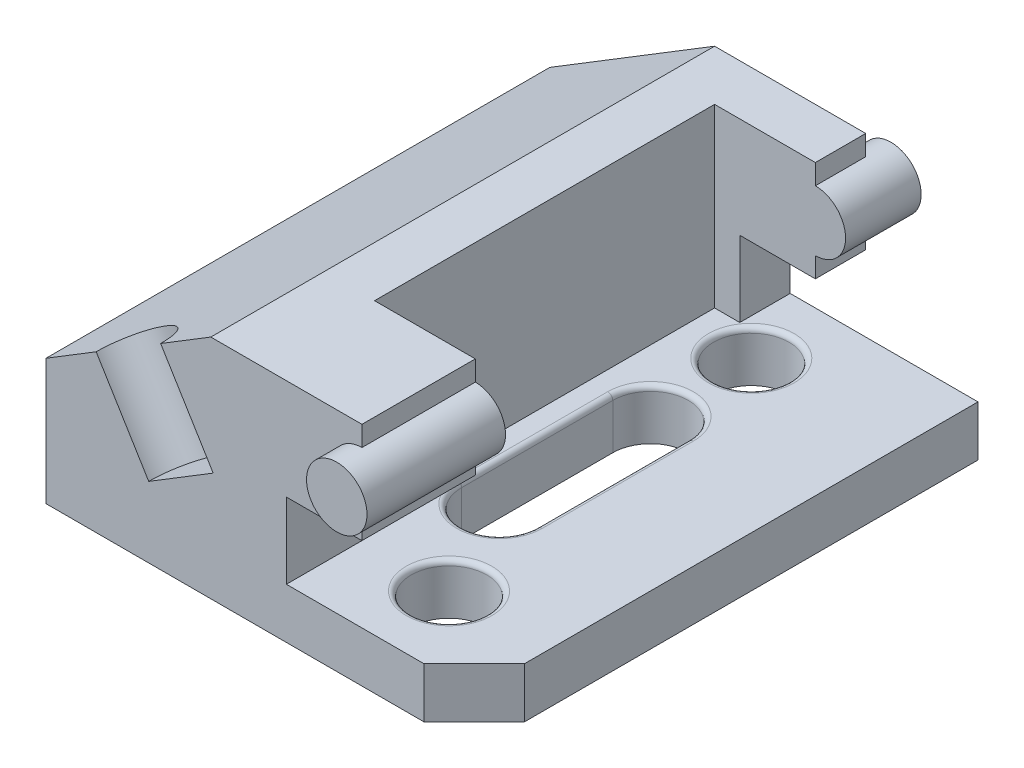
from build123d import *

# Parameters (mm, degrees)
BOSS_EXTRUDE1_DEPTH      = 100
SKETCH2_R                = 7.5
CUT_EXTRUDE2_DEPTH       = 100
SKETCH3_R                = 7.5
CUT_EXTRUDE3_DEPTH       = 100
CUT_EXTRUDE4_DEPTH       = 100
SKETCH5_R                = 7.5
CUT_EXTRUDE5_DEPTH       = 20
BOSS_EXTRUDE2_DEPTH      = 5
BOSS_EXTRUDE2_DEPTH_BACK = 105
SKETCH7_R                = 6
CUT_EXTRUDE6_START       = -35
CUT_EXTRUDE6_DEPTH       = 35
FILLET1_R                = 1


with BuildPart() as part:
    # Sketch1 → Boss-Extrude1 (new body)
    with BuildSketch(Plane.XY):
        Polygon((0, 0), (85, 0), (85, 10), (47.715081247, 10), (47.715081247, 25), (62.715081247, 25), (62.715081247, 45), (32.715081247, 45), (0, 25), align=None)
    extrude(amount=-BOSS_EXTRUDE1_DEPTH)

    # Sketch2 → Cut-Extrude2 (cut)
    with BuildSketch(Plane(origin=(0, 10, 0), x_dir=(1, 0, 0), z_dir=(0, 1, 0))):
        with Locations(Location((65, 15, 0), (0, 0, 180))):
            Circle(SKETCH2_R)
        with BuildLine():
            Line((47.5, 65), (47.5, 35))
            ThreePointArc((47.5, 35), (55, 27.5), (62.5, 35))
            Line((62.5, 35), (62.5, 65))
            ThreePointArc((62.5, 65), (55, 72.5), (47.5, 65))
        make_face()
    extrude(amount=-CUT_EXTRUDE2_DEPTH, mode=Mode.SUBTRACT)

    # Sketch3 → Cut-Extrude3 (cut)
    with BuildSketch(Plane(origin=(0, 10, 0), x_dir=(1, 0, 0), z_dir=(0, 1, 0))):
        with Locations(Location((55, 85, 0), (0, 0, 193.754716541))):
            Circle(SKETCH3_R)
    extrude(amount=-CUT_EXTRUDE3_DEPTH, mode=Mode.SUBTRACT)

    # Sketch4 → Cut-Extrude4 (cut)
    with BuildSketch(Plane(origin=(0, 10, 0), x_dir=(1, 0, 0), z_dir=(0, 1, 0))):
        Polygon((75, 0), (85, 10), (85, 0), align=None)
    extrude(amount=-CUT_EXTRUDE4_DEPTH, mode=Mode.SUBTRACT)

    # Sketch5 → Cut-Extrude5 (cut)
    with BuildSketch(Plane(origin=(-11.125485694, 18.19855842, 0), x_dir=(0.8531953684822633, 0.5215914715564423, 0), z_dir=(-0.5215914715564423, 0.8531953684822633, 0))):
        with Locations((32.211879404, 0)):
            Circle(SKETCH5_R)
    extrude(amount=-CUT_EXTRUDE5_DEPTH, mode=Mode.SUBTRACT)

    # Sketch7 → Boss-Extrude2 (add, two sides: drawn at the far end of the back side and taken through both)
    with BuildSketch(Plane.XY.offset(-BOSS_EXTRUDE2_DEPTH_BACK)):
        with Locations((62.715081247, 35)):
            Circle(SKETCH7_R)
    extrude(amount=BOSS_EXTRUDE2_DEPTH + BOSS_EXTRUDE2_DEPTH_BACK)

    # Sketch8 → Cut-Extrude6 (cut)
    with BuildSketch(Plane(origin=(0, 45, 0), x_dir=(1, 0, 0), z_dir=(0, 1, 0)).offset(CUT_EXTRUDE6_START)):
        Polygon((62.715081247, 90), (42.715081247, 90), (42.715081247, 22.5), (72.715081247, 22.5), (72.715081247, 90), align=None)
    extrude(amount=CUT_EXTRUDE6_DEPTH, mode=Mode.SUBTRACT)

    # Fillet1
    fillet1_edges = [part.edges().sort_by_distance(p)[0] for p in [
        (55, 10, -27.5),
        (55, 10, -72.5),
        (62.5, 10, -50),
        (47.5, 10, -50),
        (72.5, 10, -15),
        (62.284918753, 10, -86.783243887),
    ]]
    fillet(fillet1_edges, radius=FILLET1_R)


solid = part.part
